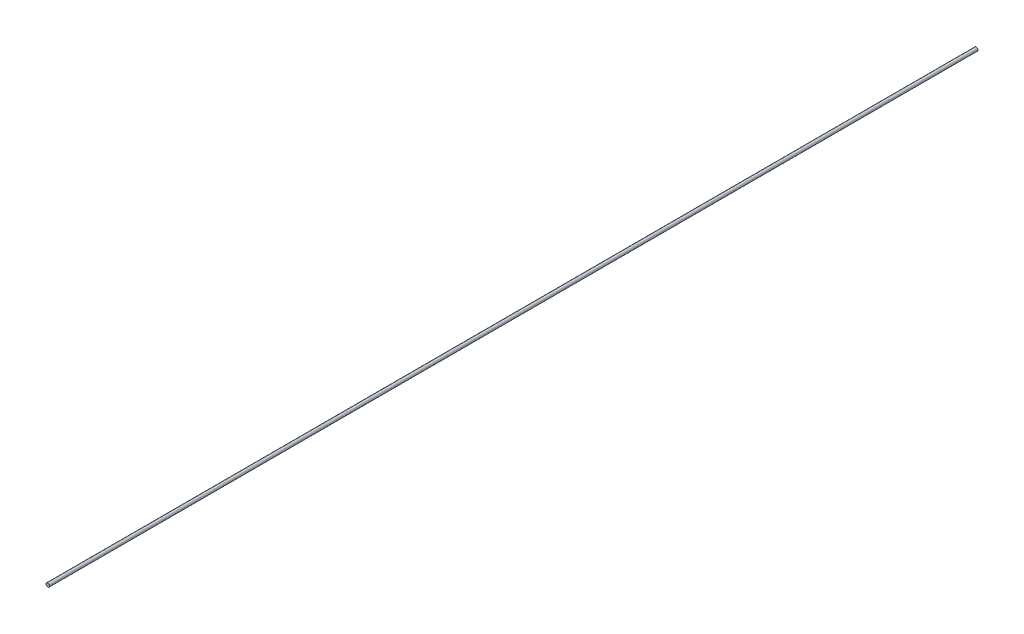
from build123d import *

# Parameters (mm, degrees)
SKETCH1_R           = 4.75
BOSS_EXTRUDE1_DEPTH = 1250


with BuildPart() as part:
    # Sketch1 → Boss-Extrude1 (new, symmetric)
    with BuildSketch(Plane.XY):
        Circle(SKETCH1_R)
    extrude(amount=BOSS_EXTRUDE1_DEPTH, both=True)


solid = part.part
